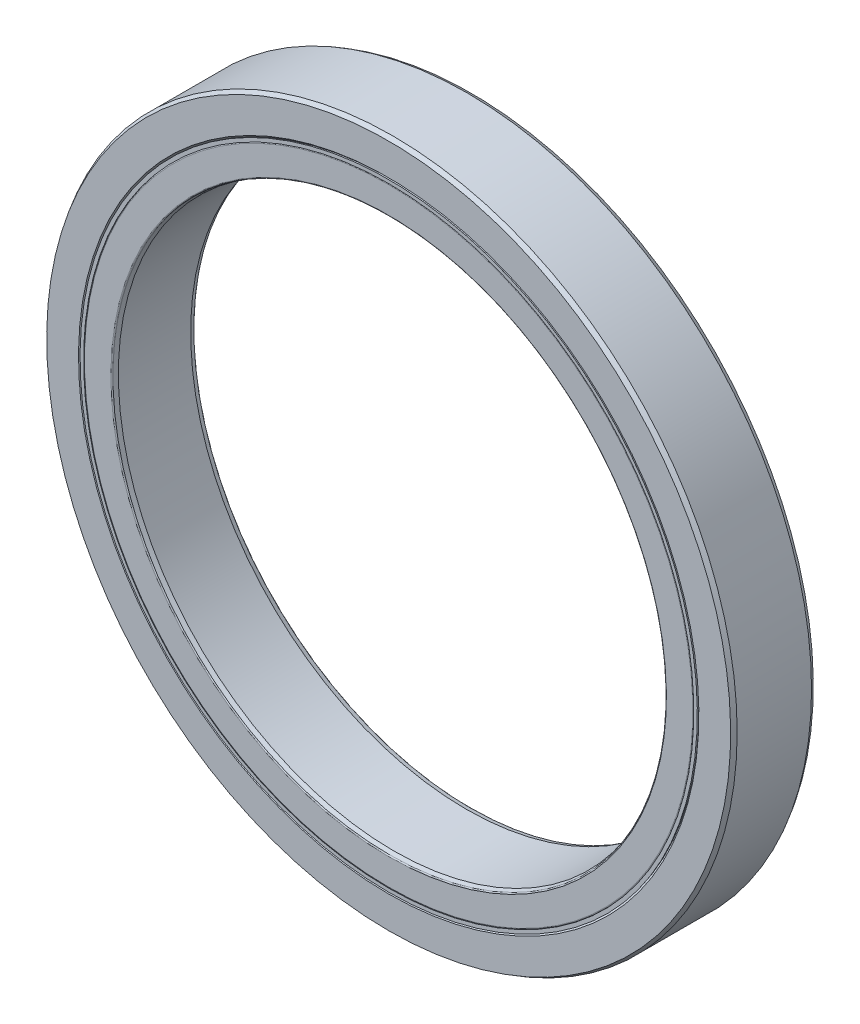
from build123d import *

# Parameters (mm, degrees)
CIRPATTERN1_COUNT = 24


with BuildPart() as part:
    # Sketch3 → Revolve1 (revolve)
    with BuildSketch(Plane(origin=(0, 0, 0), x_dir=(0, 0, -1), z_dir=(1, 0, 0)), mode=Mode.PRIVATE) as revolve1_sk:
        with BuildLine():
            Line((-2.524480927, 22.25), (-2.85, 22.368479253))
            Line((-2.85, 22.368479253), (-3, 22.518479253))
            Line((-3, 22.518479253), (-3, 24.826794919))
            Line((-3, 24.826794919), (-2.7, 25))
            Line((-2.7, 25), (2.7, 25))
            Line((2.7, 25), (3, 24.826794919))
            Line((3, 24.826794919), (3, 22.518479253))
            Line((3, 22.518479253), (2.85, 22.368479253))
            Line((2.85, 22.368479253), (2.524480927, 22.25))
            Line((2.524480927, 22.25), (1.87453698, 22.25))
            ThreePointArc((1.87453698, 22.25), (0, 24.083333333), (-1.87453698, 22.25))
            Line((-1.87453698, 22.25), (-2.524480927, 22.25))
        make_face()
    revolve(revolve1_sk.sketch.rotate(Axis((0, 0, 3), (0, 0, -1)), 180), axis=Axis((0, 0, 3), (0, 0, -1)))


with BuildPart() as body_2:
    # Sketch4 → Revolve2 (revolve)
    with BuildSketch(Plane(origin=(0, 0, 0), x_dir=(0, 0, -1), z_dir=(1, 0, 0)), mode=Mode.PRIVATE) as revolve2_sk:
        with BuildLine():
            Line((-2.62505185, 20), (-2.936056084, 20.083333333))
            ThreePointArc((-2.936056084, 20.083333333), (-2.98217197, 20.114146983), (-3, 20.166666667))
            Line((-3, 20.166666667), (-3, 22.080393652))
            ThreePointArc((-3, 22.080393652), (-2.974731219, 22.141397886), (-2.913726985, 22.166666667))
            Line((-2.913726985, 22.166666667), (-1.87453698, 22.166666667))
            ThreePointArc((-1.87453698, 22.166666667), (0, 20.333333333), (1.87453698, 22.166666667))
            Line((1.87453698, 22.166666667), (2.913726985, 22.166666667))
            ThreePointArc((2.913726985, 22.166666667), (2.974731219, 22.141397886), (3, 22.080393652))
            Line((3, 22.080393652), (3, 20.166666667))
            ThreePointArc((3, 20.166666667), (2.98217197, 20.114146983), (2.936056084, 20.083333333))
            Line((2.936056084, 20.083333333), (2.62505185, 20))
            Line((2.62505185, 20), (-2.62505185, 20))
        make_face()
    revolve(revolve2_sk.sketch.rotate(Axis((0, 0, 3), (0, 0, -1)), 180), axis=Axis((0, 0, 3), (0, 0, -1)))


with BuildPart() as body_3:
    # Sketch5 → Revolve3 (revolve)
    with BuildSketch(Plane(origin=(0, 0, 0), x_dir=(0, 0, -1), z_dir=(1, 0, 0))):
        with BuildLine():
            Line((-1.875, 22.208333333), (1.875, 22.208333333))
            ThreePointArc((1.875, 22.208333333), (0, 24.083333333), (-1.875, 22.208333333))
        make_face()
    revolve(axis=Axis((0, 22.208333333, 1.875), (0, 0, -1)))


with BuildPart() as cirpattern1_1:
    # CirPattern1: pattern copy
    add(body_3.part.rotate(Axis((0, 0, 0), (0, 0, 1)), 1 * 360 / CIRPATTERN1_COUNT))


with BuildPart() as cirpattern1_2:
    # CirPattern1: pattern copy
    add(body_3.part.rotate(Axis((0, 0, 0), (0, 0, 1)), 2 * 360 / CIRPATTERN1_COUNT))


with BuildPart() as cirpattern1_3:
    # CirPattern1: pattern copy
    add(body_3.part.rotate(Axis((0, 0, 0), (0, 0, 1)), 3 * 360 / CIRPATTERN1_COUNT))


with BuildPart() as cirpattern1_4:
    # CirPattern1: pattern copy
    add(body_3.part.rotate(Axis((0, 0, 0), (0, 0, 1)), 4 * 360 / CIRPATTERN1_COUNT))


with BuildPart() as cirpattern1_5:
    # CirPattern1: pattern copy
    add(body_3.part.rotate(Axis((0, 0, 0), (0, 0, 1)), 5 * 360 / CIRPATTERN1_COUNT))


with BuildPart() as cirpattern1_6:
    # CirPattern1: pattern copy
    add(body_3.part.rotate(Axis((0, 0, 0), (0, 0, 1)), 6 * 360 / CIRPATTERN1_COUNT))


with BuildPart() as cirpattern1_7:
    # CirPattern1: pattern copy
    add(body_3.part.rotate(Axis((0, 0, 0), (0, 0, 1)), 7 * 360 / CIRPATTERN1_COUNT))


with BuildPart() as cirpattern1_8:
    # CirPattern1: pattern copy
    add(body_3.part.rotate(Axis((0, 0, 0), (0, 0, 1)), 8 * 360 / CIRPATTERN1_COUNT))


with BuildPart() as cirpattern1_9:
    # CirPattern1: pattern copy
    add(body_3.part.rotate(Axis((0, 0, 0), (0, 0, 1)), 9 * 360 / CIRPATTERN1_COUNT))


with BuildPart() as cirpattern1_10:
    # CirPattern1: pattern copy
    add(body_3.part.rotate(Axis((0, 0, 0), (0, 0, 1)), 10 * 360 / CIRPATTERN1_COUNT))


with BuildPart() as cirpattern1_11:
    # CirPattern1: pattern copy
    add(body_3.part.rotate(Axis((0, 0, 0), (0, 0, 1)), 11 * 360 / CIRPATTERN1_COUNT))


with BuildPart() as cirpattern1_12:
    # CirPattern1: pattern copy
    add(body_3.part.rotate(Axis((0, 0, 0), (0, 0, 1)), 12 * 360 / CIRPATTERN1_COUNT))


with BuildPart() as cirpattern1_13:
    # CirPattern1: pattern copy
    add(body_3.part.rotate(Axis((0, 0, 0), (0, 0, 1)), 13 * 360 / CIRPATTERN1_COUNT))


with BuildPart() as cirpattern1_14:
    # CirPattern1: pattern copy
    add(body_3.part.rotate(Axis((0, 0, 0), (0, 0, 1)), 14 * 360 / CIRPATTERN1_COUNT))


with BuildPart() as cirpattern1_15:
    # CirPattern1: pattern copy
    add(body_3.part.rotate(Axis((0, 0, 0), (0, 0, 1)), 15 * 360 / CIRPATTERN1_COUNT))


with BuildPart() as cirpattern1_16:
    # CirPattern1: pattern copy
    add(body_3.part.rotate(Axis((0, 0, 0), (0, 0, 1)), 16 * 360 / CIRPATTERN1_COUNT))


with BuildPart() as cirpattern1_17:
    # CirPattern1: pattern copy
    add(body_3.part.rotate(Axis((0, 0, 0), (0, 0, 1)), 17 * 360 / CIRPATTERN1_COUNT))


with BuildPart() as cirpattern1_18:
    # CirPattern1: pattern copy
    add(body_3.part.rotate(Axis((0, 0, 0), (0, 0, 1)), 18 * 360 / CIRPATTERN1_COUNT))


with BuildPart() as cirpattern1_19:
    # CirPattern1: pattern copy
    add(body_3.part.rotate(Axis((0, 0, 0), (0, 0, 1)), 19 * 360 / CIRPATTERN1_COUNT))


with BuildPart() as cirpattern1_20:
    # CirPattern1: pattern copy
    add(body_3.part.rotate(Axis((0, 0, 0), (0, 0, 1)), 20 * 360 / CIRPATTERN1_COUNT))


with BuildPart() as cirpattern1_21:
    # CirPattern1: pattern copy
    add(body_3.part.rotate(Axis((0, 0, 0), (0, 0, 1)), 21 * 360 / CIRPATTERN1_COUNT))


with BuildPart() as cirpattern1_22:
    # CirPattern1: pattern copy
    add(body_3.part.rotate(Axis((0, 0, 0), (0, 0, 1)), 22 * 360 / CIRPATTERN1_COUNT))


with BuildPart() as cirpattern1_23:
    # CirPattern1: pattern copy
    add(body_3.part.rotate(Axis((0, 0, 0), (0, 0, 1)), 23 * 360 / CIRPATTERN1_COUNT))


with BuildPart() as body_27:
    # Sketch6 → Revolve4 (revolve)
    with BuildSketch(Plane(origin=(0, 0, 0), x_dir=(0, 0, -1), z_dir=(1, 0, 0)), mode=Mode.PRIVATE) as revolve4_sk:
        with BuildLine():
            Line((-2.826794919, 22.25), (-1.875, 22.25))
            Line((-1.875, 22.25), (-1.875, 22.366666667))
            Line((-1.875, 22.366666667), (-2.96, 22.366666667))
            ThreePointArc((-2.96, 22.366666667), (-2.988284271, 22.378382395), (-3, 22.406666667))
            Line((-3, 22.406666667), (-3, 22.15))
            Line((-3, 22.15), (-2.826794919, 22.25))
        make_face()
        with BuildLine():
            Line((2.96, 22.366666667), (1.875, 22.366666667))
            Line((1.875, 22.366666667), (1.875, 22.25))
            Line((1.875, 22.25), (2.826794919, 22.25))
            Line((2.826794919, 22.25), (3, 22.15))
            Line((3, 22.15), (3, 22.406666667))
            ThreePointArc((3, 22.406666667), (2.988284271, 22.378382395), (2.96, 22.366666667))
        make_face()
    revolve(revolve4_sk.sketch.rotate(Axis((0, 0, 3), (0, 0, -1)), 180), axis=Axis((0, 0, 3), (0, 0, -1)))


with BuildPart() as body_28:
    # Sketch7 → Revolve5 (revolve)
    with BuildSketch(Plane(origin=(0, 0, 0), x_dir=(0, 0, -1), z_dir=(1, 0, 0)), mode=Mode.PRIVATE) as revolve5_sk:
        with BuildLine():
            Line((-1.875, 22.366666667), (-2.854374433, 22.366666667))
            Line((-2.854374433, 22.366666667), (-2.903614821, 22.357984258))
            ThreePointArc((-2.903614821, 22.357984258), (-2.920737709, 22.335669276), (-2.9, 22.316666667))
            Line((-2.9, 22.316666667), (-2.925, 22.316666667))
            ThreePointArc((-2.925, 22.316666667), (-3, 22.241666667), (-2.925, 22.166666667))
            Line((-2.925, 22.166666667), (-1.875, 22.166666667))
            Line((-1.875, 22.166666667), (-1.875, 22.366666667))
        make_face()
    revolve(revolve5_sk.sketch.rotate(Axis((0, 0, 3), (0, 0, -1)), 180), axis=Axis((0, 0, 3), (0, 0, -1)))


solid = Compound([part.part, body_2.part, body_3.part, cirpattern1_1.part, cirpattern1_2.part, cirpattern1_3.part, cirpattern1_4.part, cirpattern1_5.part, cirpattern1_6.part, cirpattern1_7.part, cirpattern1_8.part, cirpattern1_9.part, cirpattern1_10.part, cirpattern1_11.part, cirpattern1_12.part, cirpattern1_13.part, cirpattern1_14.part, cirpattern1_15.part, cirpattern1_16.part, cirpattern1_17.part, cirpattern1_18.part, cirpattern1_19.part, cirpattern1_20.part, cirpattern1_21.part, cirpattern1_22.part, cirpattern1_23.part, body_27.part, body_28.part])
